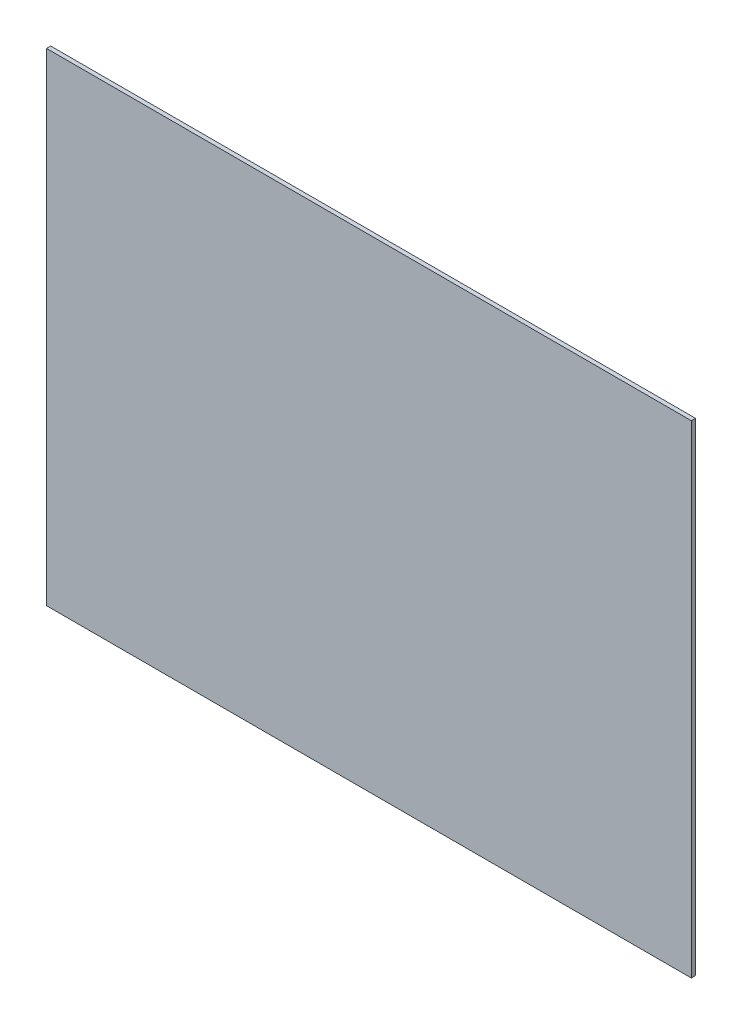
from build123d import *

# Parameters (mm, degrees)
SKETCH1_W           = 331.42
SKETCH1_H           = 248.08
BOSS_EXTRUDE1_DEPTH = 2.14


with BuildPart() as part:
    # Sketch1 → Boss-Extrude1 (new body)
    with BuildSketch(Plane.XY):
        Rectangle(SKETCH1_W, SKETCH1_H)
    extrude(amount=BOSS_EXTRUDE1_DEPTH)


solid = part.part
